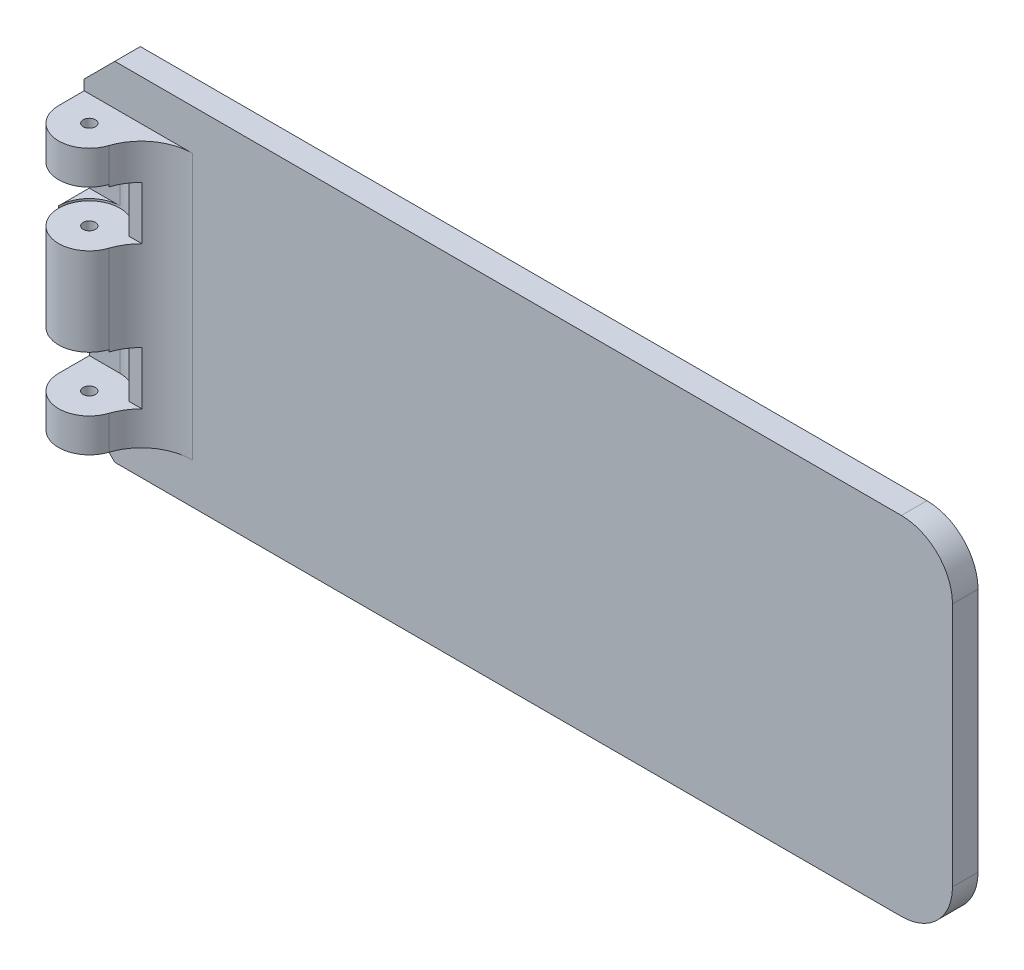
from build123d import *

# Parameters (mm, degrees)
BOSS_EXTRUDE1_DEPTH     = 34
FILLET1_R               = 5
CUT_EXTRUDE1_DEPTH      = 2.7
CUT_EXTRUDE1_DEPTH_BACK = 2.7
SKETCH3_R               = 3
CUT_EXTRUDE2_DEPTH      = 2.5
CUT_EXTRUDE2_DEPTH_BACK = 2.5
CUT_EXTRUDE3_DEPTH      = 2.7
CUT_EXTRUDE3_DEPTH_BACK = 2.7
SKETCH6_R               = 3
SKETCH7_W               = 20.448170552
SKETCH7_H               = 9.707468646
CUT_EXTRUDE4_DEPTH      = 4
SKETCH8_W               = 21.500714273
SKETCH8_H               = 8.005332222
CUT_EXTRUDE5_DEPTH      = 4
CHAMFER1_SIZE           = 3
FILLET2_R               = 5
SKETCH9_W               = 5.495998252
SKETCH9_H               = 5.2
SKETCH9_W_2             = 5.526351164
CUT_EXTRUDE6_DEPTH      = 2


with BuildPart() as part:
    # Sketch1 → Boss-Extrude1 (new body)
    with BuildSketch(Plane(origin=(0, 0, 0), x_dir=(1, 0, 0), z_dir=(0, 1, 0))):
        with BuildLine():
            Line((85, 0), (3, 0))
            Line((3, 0), (3, -2))
            ThreePointArc((3, -2), (3.866025404, -2.127718677), (4.658312395, -2.5))
            Line((4.658312395, -2.5), (85, -2.5))
            Line((85, -2.5), (85, 0))
        make_face()
        with BuildLine():
            Line((3, -2), (3, 0))
            Line((3, 0), (0, 0))
            Line((0, 0), (0, -2.5))
            Line((0, -2.5), (1.341687605, -2.5))
            ThreePointArc((1.341687605, -2.5), (2.133974596, -2.127718677), (3, -2))
        make_face()
        with BuildLine():
            ThreePointArc((0, -5), (0.356617963, -3.581362835), (1.341687605, -2.5))
            Line((1.341687605, -2.5), (0, -2.5))
            Line((0, -2.5), (0, -5))
        make_face()
        with BuildLine():
            Line((3, -4.4), (3, -2.5))
            Line((3, -2.5), (0, -5))
            ThreePointArc((0, -5), (0.878679656, -7.121320344), (3, -8))
            Line((3, -8), (3, -5.6))
            ThreePointArc((3, -5.6), (2.4, -5), (3, -4.4))
        make_face()
        with BuildLine():
            Line((4.658312395, -2.5), (3, -2.5))
            Line((3, -2.5), (3, -4.4))
            ThreePointArc((3, -4.4), (3.424264069, -4.575735931), (3.6, -5))
            ThreePointArc((3.6, -5), (3.424264069, -5.424264069), (3, -5.6))
            Line((3, -5.6), (3, -8))
            ThreePointArc((3, -8), (5.121320344, -7.121320344), (6, -5))
            ThreePointArc((6, -5), (5.643382037, -3.581362835), (4.658312395, -2.5))
        make_face()
        with BuildLine():
            Line((0, -5), (3, -2.5))
            Line((3, -2.5), (1.341687605, -2.5))
            ThreePointArc((1.341687605, -2.5), (0.356617963, -3.581362835), (0, -5))
        make_face()
        with BuildLine():
            Line((3, -2.5), (3, -2))
            ThreePointArc((3, -2), (2.133974596, -2.127718677), (1.341687605, -2.5))
            Line((1.341687605, -2.5), (3, -2.5))
        make_face()
        with BuildLine():
            ThreePointArc((4.658312395, -2.5), (3.866025404, -2.127718677), (3, -2))
            Line((3, -2), (3, -2.5))
            Line((3, -2.5), (4.658312395, -2.5))
        make_face()
    extrude(amount=BOSS_EXTRUDE1_DEPTH)

    # Fillet1
    fillet1_edges = [part.edges().sort_by_distance(p)[0] for p in [
        (4.658312395, 17, 2.5),
    ]]
    fillet(fillet1_edges, radius=FILLET1_R)

    # Sketch3 → Cut-Extrude1 (cut, two sides: drawn at the far end of the back side and taken through both)
    with BuildSketch(Plane(origin=(0, 24, 0), x_dir=(1, 0, 0), z_dir=(0, 1, 0)).offset(-CUT_EXTRUDE1_DEPTH_BACK)):
        with Locations((3, -5)):
            Circle(SKETCH3_R)
    extrude(amount=CUT_EXTRUDE1_DEPTH + CUT_EXTRUDE1_DEPTH_BACK, mode=Mode.SUBTRACT)

    # Sketch5 → Cut-Extrude2 (cut, two sides: drawn at the far end of the back side and taken through both)
    with BuildSketch(Plane(origin=(0, 24, 0), x_dir=(1, 0, 0), z_dir=(0, 1, 0)).offset(-CUT_EXTRUDE2_DEPTH_BACK)):
        Polygon((3, -2), (-2.094466052, -2), (-2.094466052, -6.13547251), (2.720170219, -6.13547251), align=None)
    extrude(amount=CUT_EXTRUDE2_DEPTH + CUT_EXTRUDE2_DEPTH_BACK, mode=Mode.SUBTRACT)

    # Sketch6 → Cut-Extrude3 (cut, two sides: drawn at the far end of the back side and taken through both)
    with BuildSketch(Plane(origin=(0, 10, 0), x_dir=(1, 0, 0), z_dir=(0, 1, 0)).offset(-CUT_EXTRUDE3_DEPTH_BACK)):
        with Locations((3, -5)):
            Circle(SKETCH6_R)
        with BuildLine():
            ThreePointArc((0, -5), (0.878679656, -2.878679656), (3, -2))
            Line((3, -2), (0, -2))
            Line((0, -2), (0, -5))
        make_face()
    extrude(amount=CUT_EXTRUDE3_DEPTH + CUT_EXTRUDE3_DEPTH_BACK, mode=Mode.SUBTRACT)

    # Sketch7 → Cut-Extrude4 (cut)
    with BuildSketch(Plane(origin=(0, 34, 0), x_dir=(1, 0, 0), z_dir=(0, 1, 0))):
        with Locations((4.670623526, -7.353734323)):
            Rectangle(SKETCH7_W, SKETCH7_H)
    extrude(amount=-CUT_EXTRUDE4_DEPTH, mode=Mode.SUBTRACT)

    # Sketch8 → Cut-Extrude5 (cut)
    with BuildSketch(Plane.XZ):
        with Locations((3.718915286, 6.502666111)):
            Rectangle(SKETCH8_W, SKETCH8_H)
    extrude(amount=-CUT_EXTRUDE5_DEPTH, mode=Mode.SUBTRACT)

    # Chamfer1
    chamfer1_edges = [part.edges().sort_by_distance(p)[0] for p in [
        (0, 0, 1.25),
        (0, 34, 1.25),
    ]]
    chamfer(chamfer1_edges, length=CHAMFER1_SIZE)

    # Fillet2
    fillet2_edges = [part.edges().sort_by_distance(p)[0] for p in [
        (85, 34, 1.25),
        (85, 0, 1.25),
    ]]
    fillet(fillet2_edges, radius=FILLET2_R)

    # Sketch9 → Cut-Extrude6 (cut)
    with BuildSketch(Plane.XY.offset(5.9375)):
        with Locations((6.215533717, 9.9)):
            Rectangle(SKETCH9_W, SKETCH9_H)
        with Locations((5.763175582, 23.9)):
            Rectangle(SKETCH9_W_2, SKETCH9_H)
    extrude(amount=-CUT_EXTRUDE6_DEPTH, mode=Mode.SUBTRACT)


solid = part.part
